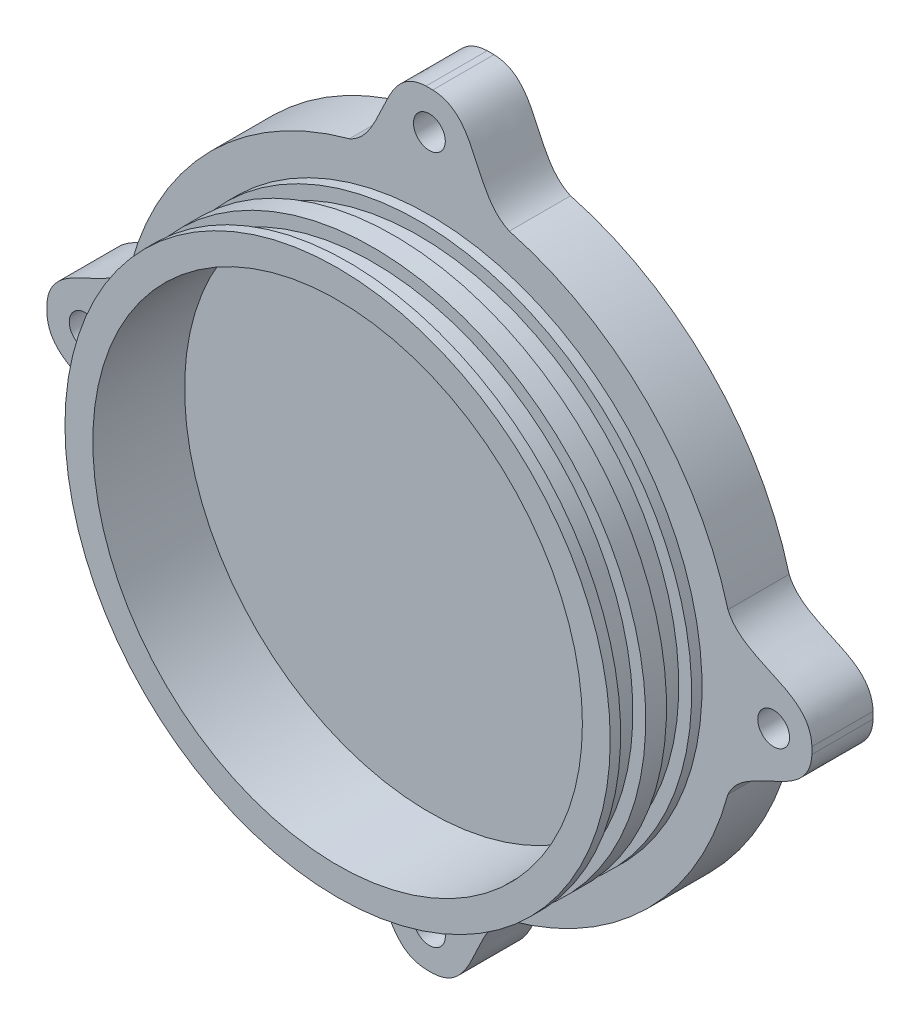
from build123d import *

# Parameters (mm, degrees)
SKETCH1_R           = 44.55
BOSS_EXTRUDE1_DEPTH = 15
SKETCH2_R           = 62.5
BOSS_EXTRUDE2_DEPTH = 10
SKETCH3_R           = 40
CUT_EXTRUDE1_DEPTH  = 15
SKETCH4_W           = 4.1
SKETCH4_H           = 2.1
SKETCH7_R           = 2.6
CUT_EXTRUDE4_DEPTH  = 92.855865354
CIRPATTERN1_COUNT   = 4
CUT_EXTRUDE6_DEPTH  = 10


with BuildPart() as part:
    # Sketch1 → Boss-Extrude1 (new body)
    with BuildSketch(Plane.XY):
        Circle(SKETCH1_R)
    extrude(amount=BOSS_EXTRUDE1_DEPTH)

    # Sketch2 → Boss-Extrude2 (add)
    with BuildSketch(Plane(origin=(0, 0, 0), x_dir=(-1, 0, 0), z_dir=(0, 0, -1))):
        Circle(SKETCH2_R)
    extrude(amount=BOSS_EXTRUDE2_DEPTH)

    # Sketch3 → Cut-Extrude1 (cut)
    with BuildSketch(Plane.XY.offset(15)):
        Circle(SKETCH3_R)
    extrude(amount=-CUT_EXTRUDE1_DEPTH, mode=Mode.SUBTRACT)

    # Sketch4 → Cut-Revolve1 (revolve, cut)
    with BuildSketch(Plane(origin=(0, 0, 0), x_dir=(0, 0, -1), z_dir=(1, 0, 0))):
        with Locations((-3.75, 43.5)):
            Rectangle(SKETCH4_W, SKETCH4_H)
        with Locations((-11.25, 43.5)):
            Rectangle(SKETCH4_W, SKETCH4_H)
    revolve(axis=Axis((0, 0, -42.713110189), (0, 0, 1)), mode=Mode.SUBTRACT)

    # Sketch7 → Cut-Extrude4 (cut, through all)
    with BuildSketch(Plane(origin=(0, 0, -10), x_dir=(-1, 0, 0), z_dir=(0, 0, -1))):
        with Locations((56.25, 0)):
            Circle(SKETCH7_R)
    cut_extrude4 = extrude(amount=-CUT_EXTRUDE4_DEPTH, mode=Mode.SUBTRACT)

    # CirPattern1: Cut-Extrude4 ×4 about axis
    cirpattern1_axis = Axis((0, 0, -45.874761596), (0, 0, 1))
    for i in range(1, CIRPATTERN1_COUNT):
        add(cut_extrude4.rotate(cirpattern1_axis, i * 360 / CIRPATTERN1_COUNT), mode=Mode.SUBTRACT)

    # Sketch10 → Cut-Extrude6 (cut)
    with BuildSketch(Plane.XY):
        with BuildLine():
            ThreePointArc((13.070361778, 48.779254228), (35.70889245, 35.70889245), (48.779254228, 13.070361778))
            add(Edge.make_bspline(
                [(62.4975392, 0.55461157), (62.208727423, 8.100511472), (51.397803822, 7.033582927), (48.779254228, 13.070361778)],
                knots=[0.023286113, 0.023286113, 0.023286113, 0.023286113, 1, 1, 1, 1], degree=3))
            ThreePointArc((62.4975392, 0.55461157), (44.194173824, 44.194173824), (0.55461157, 62.4975392))
            add(Edge.make_bspline(
                [(0.55461157, 62.4975392), (8.100511472, 62.208727423), (7.033582927, 51.397803822), (13.070361778, 48.779254228)],
                knots=[0.023286113, 0.023286113, 0.023286113, 0.023286113, 1, 1, 1, 1], degree=3))
        make_face()
        with BuildLine():
            add(Edge.make_bspline(
                [(62.4975392, -0.55461157), (62.208727423, -8.100511472), (51.397803822, -7.033582927), (48.779254228, -13.070361778)],
                knots=[0.023286113, 0.023286113, 0.023286113, 0.023286113, 1, 1, 1, 1], degree=3))
            ThreePointArc((48.779254228, -13.070361778), (35.70889245, -35.70889245), (13.070361778, -48.779254228))
            add(Edge.make_bspline(
                [(0.55461157, -62.4975392), (8.100511472, -62.208727423), (7.033582927, -51.397803822), (13.070361778, -48.779254228)],
                knots=[0.023286113, 0.023286113, 0.023286113, 0.023286113, 1, 1, 1, 1], degree=3))
            ThreePointArc((0.55461157, -62.4975392), (44.194173824, -44.194173824), (62.4975392, -0.55461157))
        make_face()
        with BuildLine():
            ThreePointArc((-48.779254228, 13.070361778), (-35.70889245, 35.70889245), (-13.070361778, 48.779254228))
            add(Edge.make_bspline(
                [(-0.55461157, 62.4975392), (-8.100511472, 62.208727423), (-7.033582927, 51.397803822), (-13.070361778, 48.779254228)],
                knots=[0.023286113, 0.023286113, 0.023286113, 0.023286113, 1, 1, 1, 1], degree=3))
            ThreePointArc((-0.55461157, 62.4975392), (-44.194173824, 44.194173824), (-62.4975392, 0.55461157))
            add(Edge.make_bspline(
                [(-62.4975392, 0.55461157), (-62.208727423, 8.100511472), (-51.397803822, 7.033582927), (-48.779254228, 13.070361778)],
                knots=[0.023286113, 0.023286113, 0.023286113, 0.023286113, 1, 1, 1, 1], degree=3))
        make_face()
        with BuildLine():
            add(Edge.make_bspline(
                [(-0.55461157, -62.4975392), (-8.100511472, -62.208727423), (-7.033582927, -51.397803822), (-13.070361778, -48.779254228)],
                knots=[0.023286113, 0.023286113, 0.023286113, 0.023286113, 1, 1, 1, 1], degree=3))
            ThreePointArc((-13.070361778, -48.779254228), (-35.70889245, -35.70889245), (-48.779254228, -13.070361778))
            add(Edge.make_bspline(
                [(-62.4975392, -0.55461157), (-62.208727423, -8.100511472), (-51.397803822, -7.033582927), (-48.779254228, -13.070361778)],
                knots=[0.023286113, 0.023286113, 0.023286113, 0.023286113, 1, 1, 1, 1], degree=3))
            ThreePointArc((-62.4975392, -0.55461157), (-44.194173824, -44.194173824), (-0.55461157, -62.4975392))
        make_face()
    extrude(amount=-CUT_EXTRUDE6_DEPTH, mode=Mode.SUBTRACT)


solid = part.part
